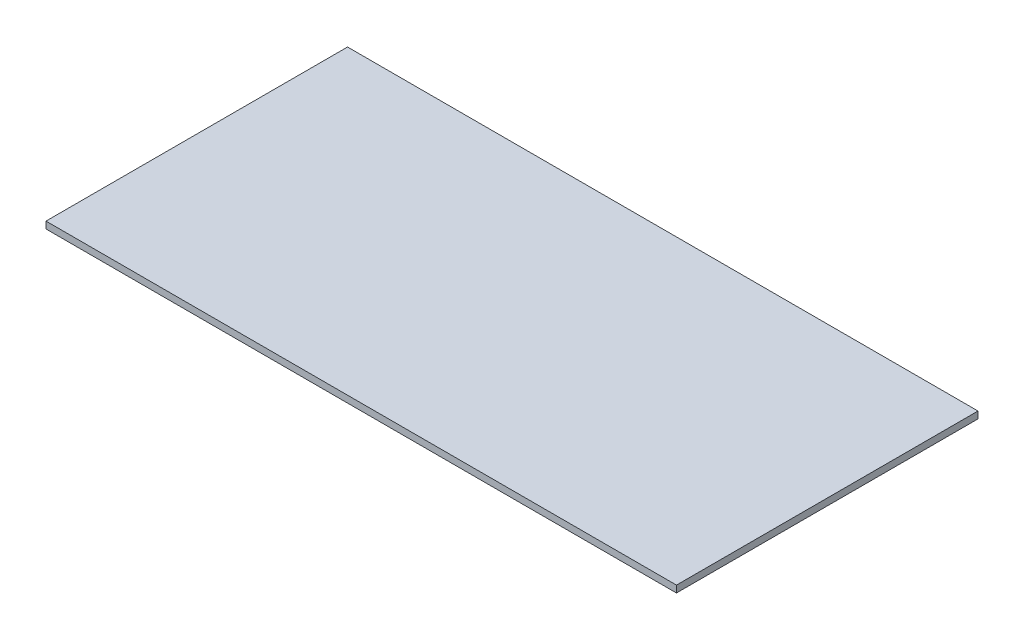
from build123d import *

# Parameters (mm, degrees)
SKETCH1_W       = 584.2
SKETCH1_H       = 279.4
BASEPLATE_DEPTH = 6.35


with BuildPart() as part:
    # Sketch1 → Baseplate (new body)
    with BuildSketch(Plane(origin=(0, 0, 0), x_dir=(1, 0, 0), z_dir=(0, 1, 0))):
        Rectangle(SKETCH1_W, SKETCH1_H)
    extrude(amount=BASEPLATE_DEPTH)


solid = part.part
